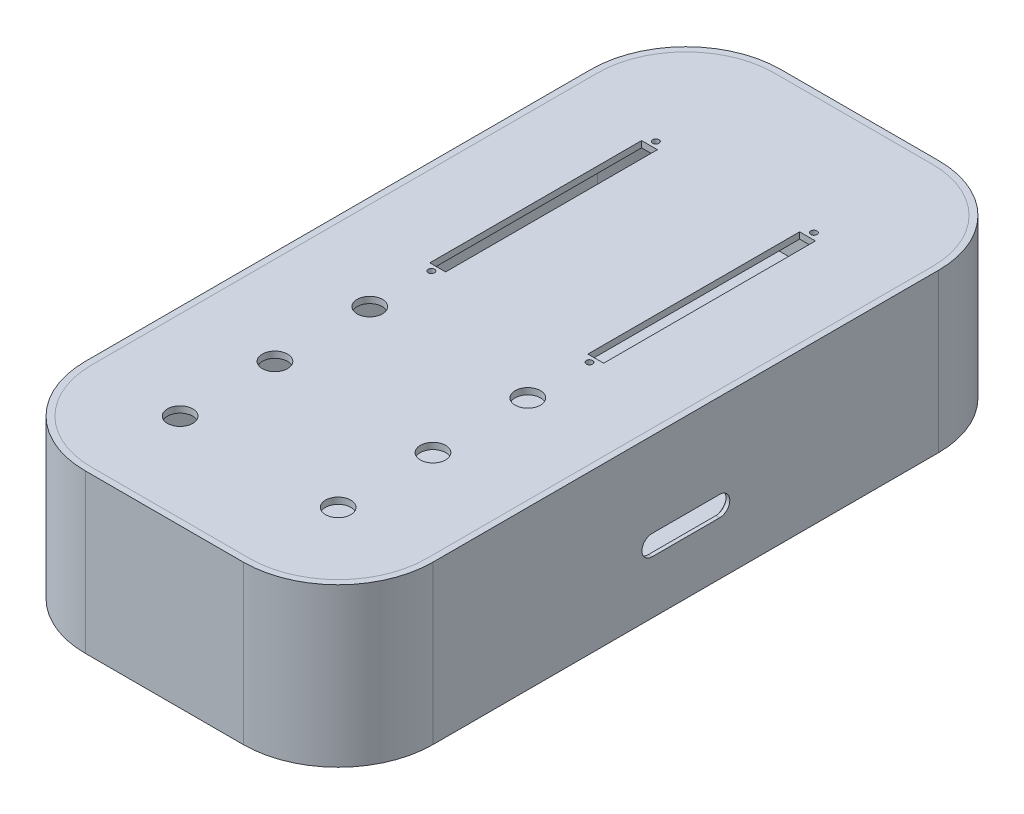
from build123d import *

# Parameters (mm, degrees)
BOSS_EXTRUDE1_DEPTH = 50
SHELL1_T            = -2
BOSS_EXTRUDE2_START = 44
BOSS_EXTRUDE2_DEPTH = 2
BOSS_EXTRUDE3_START = 48
BOSS_EXTRUDE3_DEPTH = 2
SKETCH3_R           = 4
SKETCH3_R_2         = 1
SKETCH3_W           = 5
SKETCH3_H           = 67
CUT_EXTRUDE1_DEPTH  = 2
CUT_EXTRUDE2_DEPTH  = 2
CUT_EXTRUDE3_START  = -2
CUT_EXTRUDE3_DEPTH  = 0.8


with BuildPart() as part:
    # Sketch1 → Boss-Extrude1 (new body)
    with BuildSketch(Plane(origin=(0, 0, 0), x_dir=(1, 0, 0), z_dir=(0, 1, 0))):
        with BuildLine():
            Line((-25, -110), (25, -110))
            ThreePointArc((25, -110), (46.213203436, -101.213203436), (55, -80))
            Line((55, -80), (55, 80))
            ThreePointArc((55, 80), (46.213203436, 101.213203436), (25, 110))
            Line((25, 110), (-25, 110))
            ThreePointArc((-25, 110), (-46.213203436, 101.213203436), (-55, 80))
            Line((-55, 80), (-55, -80))
            ThreePointArc((-55, -80), (-46.213203436, -101.213203436), (-25, -110))
        make_face()
    extrude(amount=BOSS_EXTRUDE1_DEPTH)

    # Shell1
    shell1_openings = [part.faces().sort_by_distance(p)[0] for p in [
        (0, 50, 0),
    ]]
    offset(amount=SHELL1_T, openings=shell1_openings, kind=Kind.INTERSECTION)

    # Sketch2 → Boss-Extrude2 (add)
    with BuildSketch(Plane(origin=(0, 2, 0), x_dir=(1, 0, 0), z_dir=(0, 1, 0)).offset(BOSS_EXTRUDE2_START)):
        with BuildLine():
            Line((-53, 80), (-53, -80))
            ThreePointArc((-53, -80), (-44.798989873, -99.798989873), (-25, -108))
            Line((-25, -108), (25, -108))
            ThreePointArc((25, -108), (44.798989873, -99.798989873), (53, -80))
            Line((53, -80), (53, 80))
            ThreePointArc((53, 80), (44.798989873, 99.798989873), (25, 108))
            Line((25, 108), (-25, 108))
            ThreePointArc((-25, 108), (-44.798989873, 99.798989873), (-53, 80))
        make_face()
        with BuildLine():
            ThreePointArc((-25, 102), (-40.556349186, 95.556349186), (-47, 80))
            Line((-47, 80), (-47, -80))
            ThreePointArc((-47, -80), (-40.556349186, -95.556349186), (-25, -102))
            Line((-25, -102), (25, -102))
            ThreePointArc((25, -102), (40.556349186, -95.556349186), (47, -80))
            Line((47, -80), (47, 80))
            ThreePointArc((47, 80), (40.556349186, 95.556349186), (25, 102))
            Line((25, 102), (-25, 102))
        make_face(mode=Mode.SUBTRACT)
    extrude(amount=BOSS_EXTRUDE2_DEPTH)

    # Sketch4 → Cut-Extrude2 (cut)
    with BuildSketch(Plane(origin=(55, 0, 0), x_dir=(0, 0, -1), z_dir=(1, 0, 0))):
        with BuildLine():
            Line((-10.7, 16.8), (10.7, 16.8))
            ThreePointArc((10.7, 16.8), (13.9, 20), (10.7, 23.2))
            Line((10.7, 23.2), (-10.7, 23.2))
            ThreePointArc((-10.7, 23.2), (-13.9, 20), (-10.7, 16.8))
        make_face()
    extrude(amount=-CUT_EXTRUDE2_DEPTH, mode=Mode.SUBTRACT)

    # Sketch4<4> → Cut-Extrude3 (cut)
    with BuildSketch(Plane(origin=(55, 0, 0), x_dir=(0, 0, -1), z_dir=(1, 0, 0)).offset(CUT_EXTRUDE3_START)):
        with BuildLine():
            Line((-10.7, 24.2), (10.7, 24.2))
            ThreePointArc((10.7, 24.2), (14.9, 20), (10.7, 15.8))
            Line((10.7, 15.8), (-10.7, 15.8))
            ThreePointArc((-10.7, 15.8), (-14.9, 20), (-10.7, 24.2))
        make_face()
        with BuildLine():
            Line((-10.7, 23.2), (10.7, 23.2))
            ThreePointArc((10.7, 23.2), (13.9, 20), (10.7, 16.8))
            Line((10.7, 16.8), (-10.7, 16.8))
            ThreePointArc((-10.7, 16.8), (-13.9, 20), (-10.7, 23.2))
        make_face(mode=Mode.SUBTRACT)
    extrude(amount=CUT_EXTRUDE3_DEPTH, mode=Mode.SUBTRACT)


with BuildPart() as body_2:
    # Sketch1<3> → Boss-Extrude3 (new body)
    with BuildSketch(Plane(origin=(0, 0, 0), x_dir=(1, 0, 0), z_dir=(0, 1, 0)).offset(BOSS_EXTRUDE3_START)):
        with BuildLine():
            Line((-53, -80), (-53, 80))
            ThreePointArc((-53, 80), (-44.798989873, 99.798989873), (-25, 108))
            Line((-25, 108), (25, 108))
            ThreePointArc((25, 108), (44.798989873, 99.798989873), (53, 80))
            Line((53, 80), (53, -80))
            ThreePointArc((53, -80), (44.798989873, -99.798989873), (25, -108))
            Line((25, -108), (-25, -108))
            ThreePointArc((-25, -108), (-44.798989873, -99.798989873), (-53, -80))
        make_face()
    extrude(amount=BOSS_EXTRUDE3_DEPTH)

    # Sketch3 → Cut-Extrude1 (cut)
    with BuildSketch(Plane.XZ.offset(-48)):
        with Locations(Location((-25, 80, 0), (0, 0, 270))):
            Circle(SKETCH3_R)
        with Locations(Location((25, 80, 0), (0, 0, 270))):
            Circle(SKETCH3_R)
        with Locations(Location((-25, 50, 0), (0, 0, 270))):
            Circle(SKETCH3_R)
        with Locations(Location((25, 50, 0), (0, 0, 270))):
            Circle(SKETCH3_R)
        with Locations(Location((-25, 20, 0), (0, 0, 270))):
            Circle(SKETCH3_R)
        with Locations(Location((25, 20, 0), (0, 0, 270))):
            Circle(SKETCH3_R)
        with Locations(Location((-25, 0.5, 0), (0, 0, 270))):
            Circle(SKETCH3_R_2)
        with Locations(Location((25, 0.5, 0), (0, 0, 270))):
            Circle(SKETCH3_R_2)
        with Locations(Location((25, -70.5, 0), (0, 0, 270))):
            Circle(SKETCH3_R_2)
        with Locations(Location((-25, -70.5, 0), (0, 0, 270))):
            Circle(SKETCH3_R_2)
        with Locations((-25, -35)):
            Rectangle(SKETCH3_W, SKETCH3_H)
        with Locations((25, -35)):
            Rectangle(SKETCH3_W, SKETCH3_H)
    extrude(amount=-CUT_EXTRUDE1_DEPTH, mode=Mode.SUBTRACT)


solid = Compound([part.part, body_2.part])
